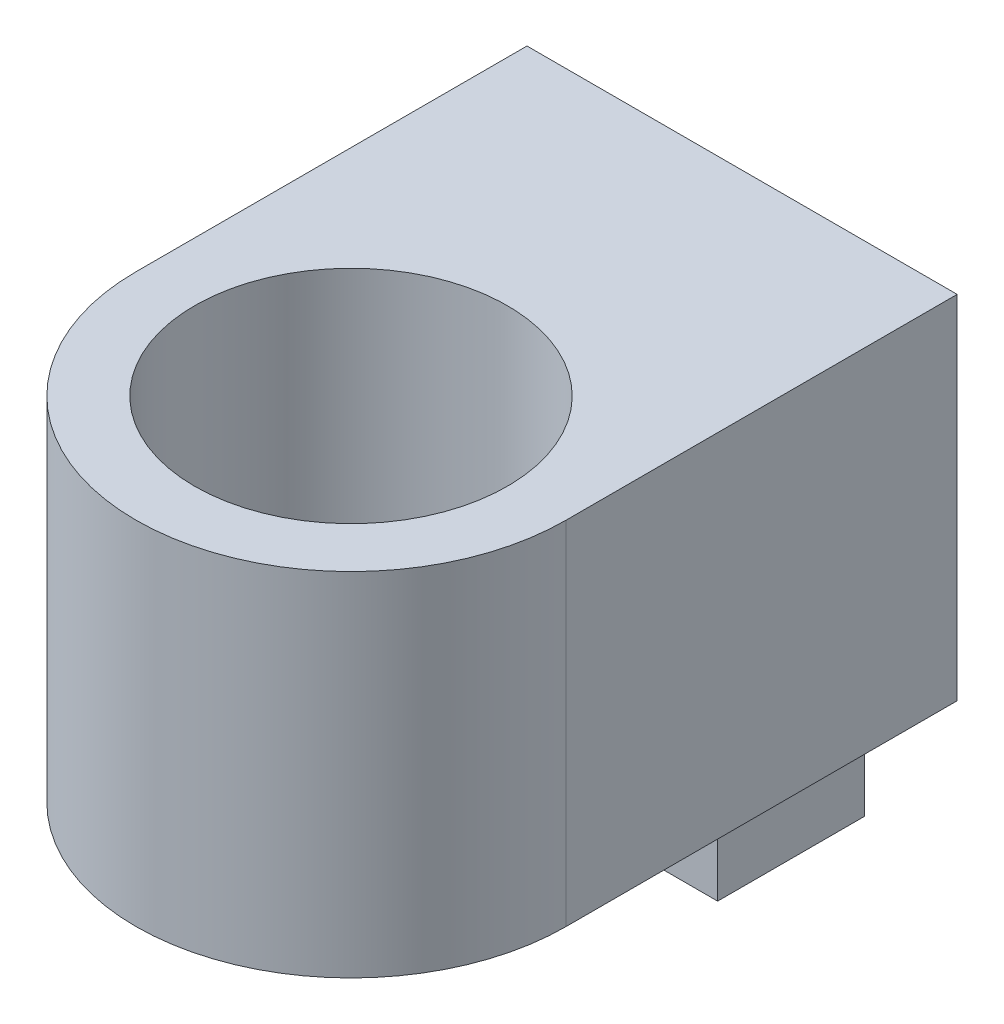
from build123d import *

# Parameters (mm, degrees)
SKETCH1_R           = 8
BOSS_EXTRUDE1_DEPTH = 18
SKETCH2_R           = 6
CUT_EXTRUDE1_DEPTH  = 10
SKETCH4_W           = 17.5
SKETCH4_H           = 7.5
BOSS_EXTRUDE3_DEPTH = 5


with BuildPart() as part:
    # Sketch1 → Boss-Extrude1 (new body)
    with BuildSketch(Plane(origin=(0, 0, 0), x_dir=(1, 0, 0), z_dir=(0, 1, 0))):
        with BuildLine():
            Line((-11, 0), (-11, 20))
            Line((-11, 20), (11, 20))
            Line((11, 20), (11, 0))
            ThreePointArc((11, 0), (0, -11), (-11, 0))
        make_face()
        with Locations(Location((0, 0, 0), (0, 0, 270))):
            Circle(SKETCH1_R, mode=Mode.SUBTRACT)
    extrude(amount=BOSS_EXTRUDE1_DEPTH)

    # Sketch2 → Cut-Extrude1 (cut)
    with BuildSketch(Plane(origin=(0, 0, -20), x_dir=(-1, 0, 0), z_dir=(0, 0, -1))):
        with Locations((0, 9)):
            Circle(SKETCH2_R)
    extrude(amount=-CUT_EXTRUDE1_DEPTH, mode=Mode.SUBTRACT)

    # Sketch4 → Boss-Extrude3 (add)
    with BuildSketch(Plane.XZ):
        with Locations((0, -13.75)):
            Rectangle(SKETCH4_W, SKETCH4_H)
    extrude(amount=BOSS_EXTRUDE3_DEPTH)


solid = part.part
